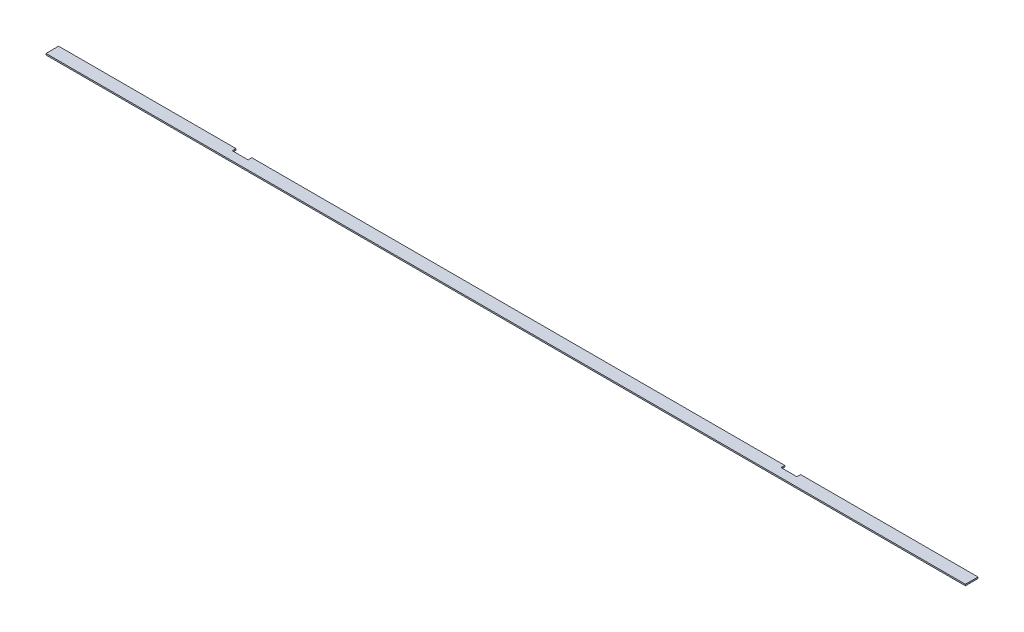
from build123d import *

# Parameters (mm, degrees)
SKETCH_1_W          = 27
SKETCH_1_H          = 3
EXTRUDE_1_DEPTH     = 985
CUT_EXTRUDE_1_REACH = 987.097
SKETCH_2_W          = 34
SKETCH_2_H          = 22.55300249


with BuildPart() as part:
    # Эскиз1 → Бобышка-Вытянуть1 (new, symmetric)
    with BuildSketch(Plane(origin=(0, 0, 0), x_dir=(0, 0, -1), z_dir=(1, 0, 0))):
        Rectangle(SKETCH_1_W, SKETCH_1_H)
    extrude(amount=EXTRUDE_1_DEPTH, both=True)

    # Эскиз2 → Вырез-Вытянуть1 (cut, up to next)
    with BuildSketch(Plane.XZ.offset(1.5), mode=Mode.PRIVATE) as cut_extrude_1_sk1:
        with Locations((-588, -16.776501245)):
            Rectangle(SKETCH_2_W, SKETCH_2_H)
    cut_extrude_1_tool1 = extrude(cut_extrude_1_sk1.sketch, amount=-CUT_EXTRUDE_1_REACH, mode=Mode.PRIVATE) & part.part
    cut_extrude_1 = cut_extrude_1_tool1.solids().sort_by_distance((-588, -1.5, -16.776501))[0]
    add(cut_extrude_1, mode=Mode.SUBTRACT)

    # Зеркальное отражение1: Вырез-Вытянуть1 across plane
    add(cut_extrude_1.mirror(Plane(origin=(0, 0, 0), x_dir=(0, 0, 1), z_dir=(1, 0, 0))), mode=Mode.SUBTRACT)


solid = part.part
